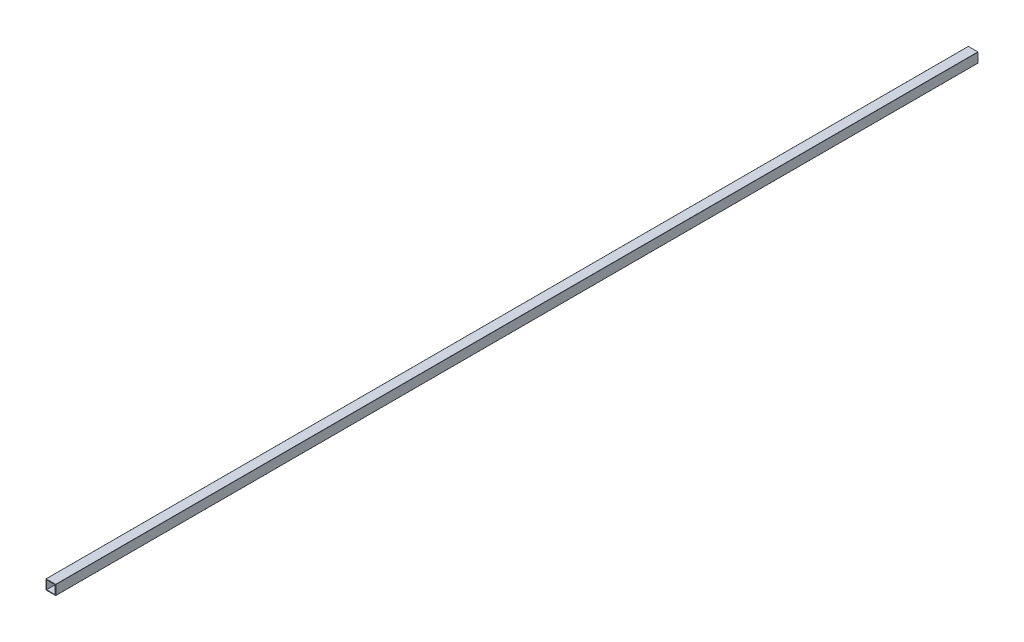
from build123d import *

# Parameters (mm, degrees)
CROQUIS1_W              = 55.9
CROQUIS1_H              = 55.9
SALIENTE_EXTRUIR1_DEPTH = 6000


with BuildPart() as part:
    # Croquis1 → Saliente-Extruir1 (new body)
    with BuildSketch(Plane.XY):
        with BuildLine():
            Line((-30.75, -31.75), (30.75, -31.75))
            ThreePointArc((30.75, -31.75), (31.457106781, -31.457106781), (31.75, -30.75))
            Line((31.75, -30.75), (31.75, 30.75))
            ThreePointArc((31.75, 30.75), (31.457106781, 31.457106781), (30.75, 31.75))
            Line((30.75, 31.75), (-30.75, 31.75))
            ThreePointArc((-30.75, 31.75), (-31.457106781, 31.457106781), (-31.75, 30.75))
            Line((-31.75, 30.75), (-31.75, -30.75))
            ThreePointArc((-31.75, -30.75), (-31.457106781, -31.457106781), (-30.75, -31.75))
        make_face()
        Rectangle(CROQUIS1_W, CROQUIS1_H, mode=Mode.SUBTRACT)
    extrude(amount=SALIENTE_EXTRUIR1_DEPTH)


solid = part.part
